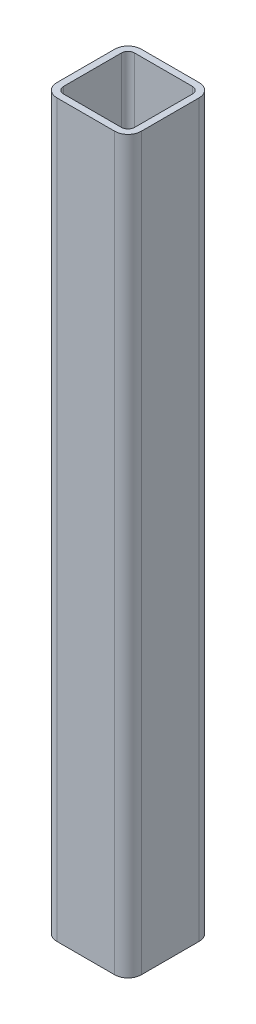
from build123d import *

# Parameters (mm, degrees)
SQUARE_TUBE_20_X_20_X_2_1_DEPTH = 220


with BuildPart() as part:
    # Sketch1 → Square tube 20 X 20 X 2(1) (new body)
    with BuildSketch(Plane(origin=(0, 0, 0), x_dir=(1, 0, 0), z_dir=(0, 1, 0))):
        with BuildLine():
            Line((-8.7, -12.7), (8.7, -12.7))
            ThreePointArc((8.7, -12.7), (11.528427125, -11.528427125), (12.7, -8.7))
            Line((12.7, -8.7), (12.7, 8.7))
            ThreePointArc((12.7, 8.7), (11.528427125, 11.528427125), (8.7, 12.7))
            Line((8.7, 12.7), (-8.7, 12.7))
            ThreePointArc((-8.7, 12.7), (-11.528427125, 11.528427125), (-12.7, 8.7))
            Line((-12.7, 8.7), (-12.7, -8.7))
            ThreePointArc((-12.7, -8.7), (-11.528427125, -11.528427125), (-8.7, -12.7))
        make_face()
        with BuildLine():
            Line((-8.7, -10.7), (8.7, -10.7))
            ThreePointArc((8.7, -10.7), (10.114213562, -10.114213562), (10.7, -8.7))
            Line((10.7, -8.7), (10.7, 8.7))
            ThreePointArc((10.7, 8.7), (10.114213562, 10.114213562), (8.7, 10.7))
            Line((8.7, 10.7), (-8.7, 10.7))
            ThreePointArc((-8.7, 10.7), (-10.114213562, 10.114213562), (-10.7, 8.7))
            Line((-10.7, 8.7), (-10.7, -8.7))
            ThreePointArc((-10.7, -8.7), (-10.114213562, -10.114213562), (-8.7, -10.7))
        make_face(mode=Mode.SUBTRACT)
    extrude(amount=SQUARE_TUBE_20_X_20_X_2_1_DEPTH)


solid = part.part
